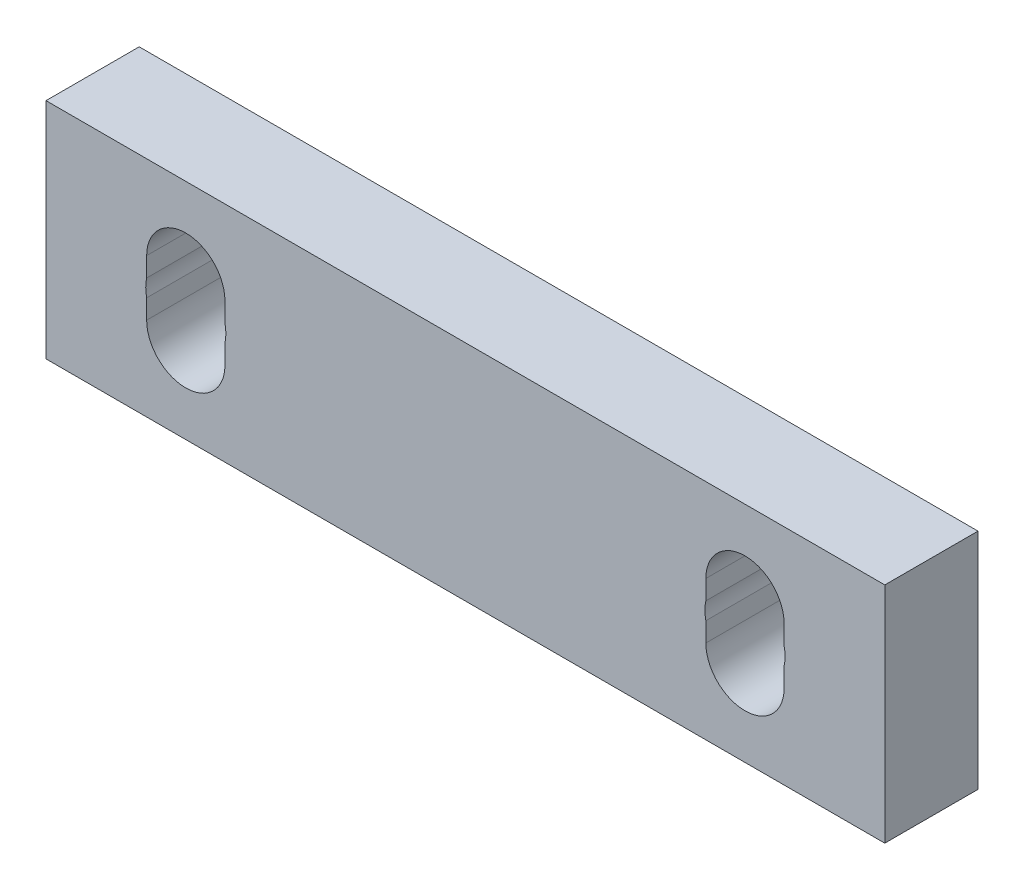
from build123d import *

# Parameters (mm, degrees)
SKETCH1_W           = 45
SKETCH1_H           = 12
SKETCH1_R           = 2.15
BOSS_EXTRUDE1_DEPTH = 5
CUT_EXTRUDE1_DEPTH  = 24.817010728


with BuildPart() as part:
    # Sketch1 → Boss-Extrude1 (new body)
    with BuildSketch(Plane.XY):
        Rectangle(SKETCH1_W, SKETCH1_H)
        with Locations((-15, 0)):
            Circle(SKETCH1_R, mode=Mode.SUBTRACT)
        with Locations((15, 0)):
            Circle(SKETCH1_R, mode=Mode.SUBTRACT)
    extrude(amount=BOSS_EXTRUDE1_DEPTH)

    # Sketch2 → Cut-Extrude1 (cut, through all)
    with BuildSketch(Plane.XY.offset(5)):
        with BuildLine():
            Line((-12.9, 1.5), (-12.9, -1.5))
            ThreePointArc((-12.9, -1.5), (-15, -3.6), (-17.1, -1.5))
            Line((-17.1, -1.5), (-17.1, 1.5))
            ThreePointArc((-17.1, 1.5), (-15, 3.6), (-12.9, 1.5))
        make_face()
        with BuildLine():
            Line((12.9, -1.5), (12.9, 1.5))
            ThreePointArc((12.9, 1.5), (15, 3.6), (17.1, 1.5))
            Line((17.1, 1.5), (17.1, -1.5))
            ThreePointArc((17.1, -1.5), (15, -3.6), (12.9, -1.5))
        make_face()
    extrude(amount=-CUT_EXTRUDE1_DEPTH, mode=Mode.SUBTRACT)


solid = part.part
